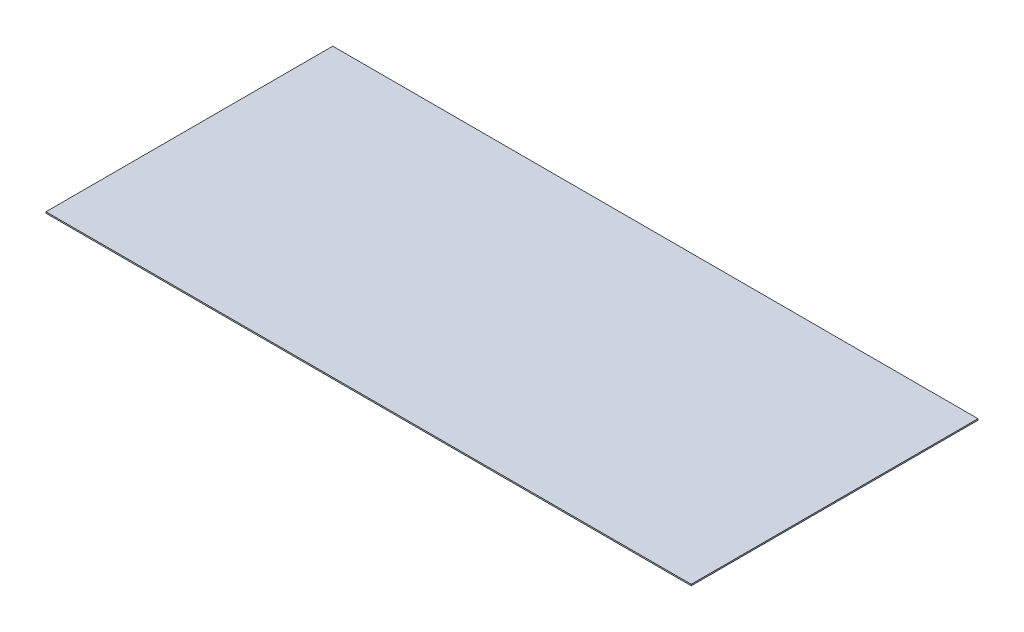
from build123d import *

# Parameters (mm, degrees)
CROQUIS1_W              = 900
CROQUIS1_H              = 400
SALIENTE_EXTRUIR1_DEPTH = 1.9


with BuildPart() as part:
    # Croquis1 → Saliente-Extruir1 (new body)
    with BuildSketch(Plane(origin=(0, 0, 0), x_dir=(1, 0, 0), z_dir=(0, 1, 0))):
        Rectangle(CROQUIS1_W, CROQUIS1_H)
    extrude(amount=SALIENTE_EXTRUIR1_DEPTH)


solid = part.part
